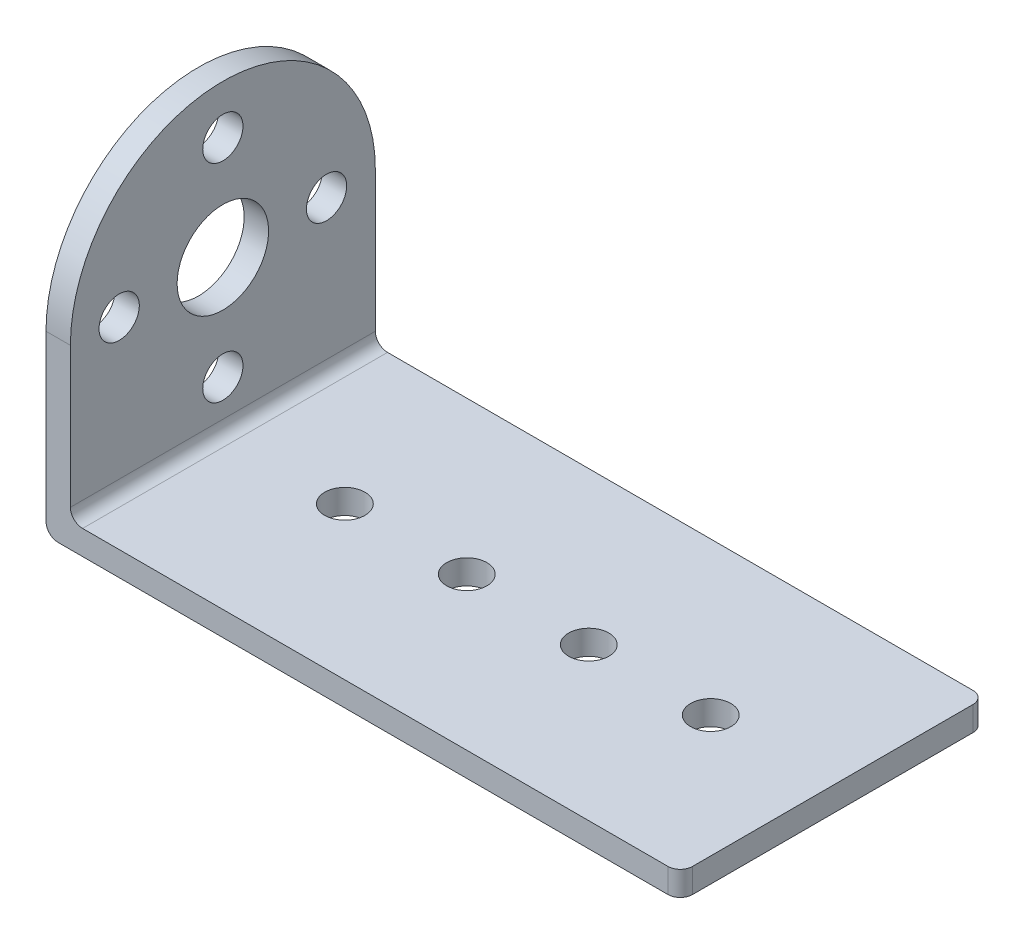
from build123d import *

# Parameters (mm, degrees)
SKETCH3_W           = 52
SKETCH3_H           = 25
BOSS_EXTRUDE3_DEPTH = 2
SKETCH4_W           = 25
SKETCH4_H           = 14.5
BOSS_EXTRUDE4_DEPTH = 2
BOSS_EXTRUDE5_DEPTH = 2
SKETCH6_R           = 1.65
CUT_EXTRUDE1_DEPTH  = 2
SKETCH7_R           = 3.75
SKETCH7_R_2         = 1.65
CUT_EXTRUDE2_DEPTH  = 2
FILLET1_R           = 1


with BuildPart() as part:
    # Sketch3 → Boss-Extrude3 (new body)
    with BuildSketch(Plane(origin=(0, 0, 0), x_dir=(1, 0, 0), z_dir=(0, 1, 0))):
        with Locations((26, 12.5)):
            Rectangle(SKETCH3_W, SKETCH3_H)
    extrude(amount=BOSS_EXTRUDE3_DEPTH)

    # Sketch4 → Boss-Extrude4 (add)
    with BuildSketch(Plane(origin=(0, 0, 0), x_dir=(0, 0, -1), z_dir=(1, 0, 0))):
        with Locations((12.5, 7.25)):
            Rectangle(SKETCH4_W, SKETCH4_H)
    extrude(amount=BOSS_EXTRUDE4_DEPTH)

    # Sketch5 → Boss-Extrude5 (add)
    with BuildSketch(Plane.ZY):
        with BuildLine():
            Line((-25, 0), (0, 0))
            Line((0, 0), (0, 14.5))
            ThreePointArc((0, 14.5), (-12.5, 27), (-25, 14.5))
            Line((-25, 14.5), (-25, 0))
        make_face()
    extrude(amount=-BOSS_EXTRUDE5_DEPTH)

    # Sketch6 → Cut-Extrude1 (cut)
    with BuildSketch(Plane(origin=(0, 2, 0), x_dir=(1, 0, 0), z_dir=(0, 1, 0))):
        with Locations(Location((12, 12.5, 0), (0, 0, 270))):
            Circle(SKETCH6_R)
        with Locations(Location((22, 12.5, 0), (0, 0, 270))):
            Circle(SKETCH6_R)
        with Locations(Location((32, 12.5, 0), (0, 0, 270))):
            Circle(SKETCH6_R)
        with Locations(Location((42, 12.5, 0), (0, 0, 270))):
            Circle(SKETCH6_R)
    extrude(amount=-CUT_EXTRUDE1_DEPTH, mode=Mode.SUBTRACT)

    # Sketch7 → Cut-Extrude2 (cut)
    with BuildSketch(Plane.ZY):
        with Locations((-12.5, 14.5)):
            Circle(SKETCH7_R)
        with Locations((-21, 14.5)):
            Circle(SKETCH7_R_2)
        with Locations((-4, 14.5)):
            Circle(SKETCH7_R_2)
        with Locations((-12.5, 6)):
            Circle(SKETCH7_R_2)
        with Locations((-12.5, 23)):
            Circle(SKETCH7_R_2)
    extrude(amount=-CUT_EXTRUDE2_DEPTH, mode=Mode.SUBTRACT)

    # Fillet1
    fillet1_edges = [part.edges().sort_by_distance(p)[0] for p in [
        (2, 2, -12.5),
        (0, 0, -12.5),
        (52, 1, -25),
        (52, 1, 0),
    ]]
    fillet(fillet1_edges, radius=FILLET1_R)


solid = part.part
